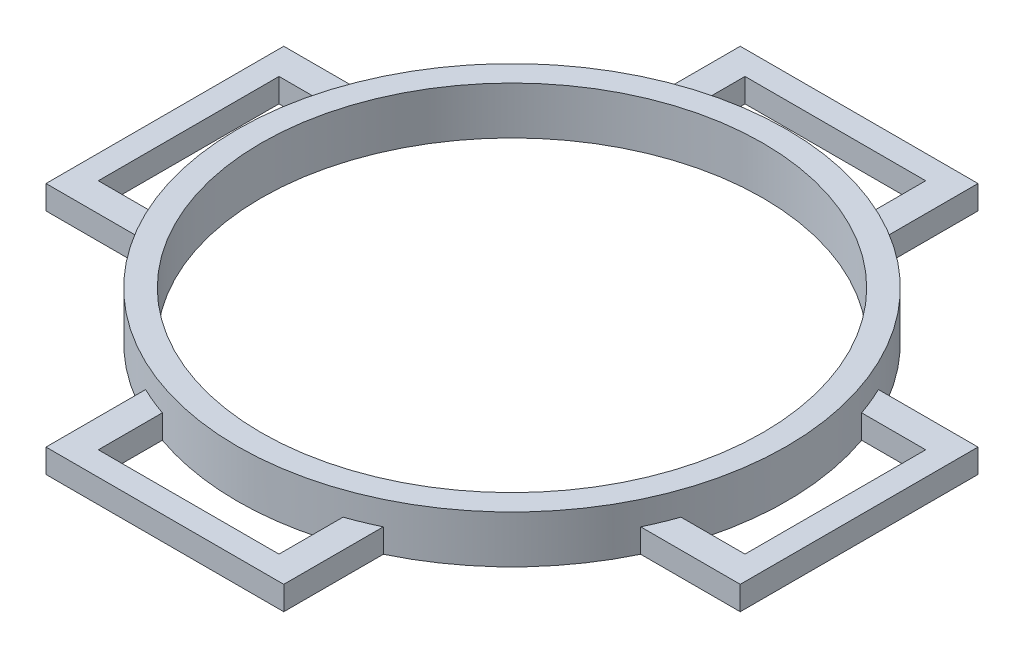
from build123d import *

# Parameters (mm, degrees)
CROQUIS1_W              = 1
CROQUIS1_H              = 2
SALIENTE_EXTRUIR1_START = -1
SALIENTE_EXTRUIR1_DEPTH = 1
MATRIZC1_COUNT          = 4


with BuildPart() as part:
    # Croquis1 → Revolución1 (revolve)
    with BuildSketch(Plane.XY, mode=Mode.PRIVATE) as revoluci_n1_sk:
        with Locations((11.05, 0)):
            Rectangle(CROQUIS1_W, CROQUIS1_H)
    revolve(revoluci_n1_sk.sketch.rotate(Axis((0, 18.472461404, 0), (0, -1, 0)), 90), axis=Axis((0, 18.472461404, 0), (0, -1, 0)))

    # Croquis2 → Saliente-Extruir1 (add)
    with BuildSketch(Plane(origin=(0, 0, 0), x_dir=(1, 0, 0), z_dir=(0, 1, 0)).offset(SALIENTE_EXTRUIR1_START)):
        Polygon((-5, -10.411652126), (-5, -14.6), (5, -14.6), (5, -10.411652126), (3.8, -10.411652126), (3.8, -10.90699317), (3.8, -13.6), (-3.8, -13.6), (-3.8, -10.90699317), (-3.8, -10.411652126), align=None)
    saliente_extruir1 = extrude(amount=SALIENTE_EXTRUIR1_DEPTH)

    # MatrizC1: Saliente-Extruir1 ×4 about axis
    matrizc1_axis = Axis((0, 0, 0), (0, 1, 0))
    for i in range(1, MATRIZC1_COUNT):
        add(saliente_extruir1.rotate(matrizc1_axis, i * 360 / MATRIZC1_COUNT))


solid = part.part
